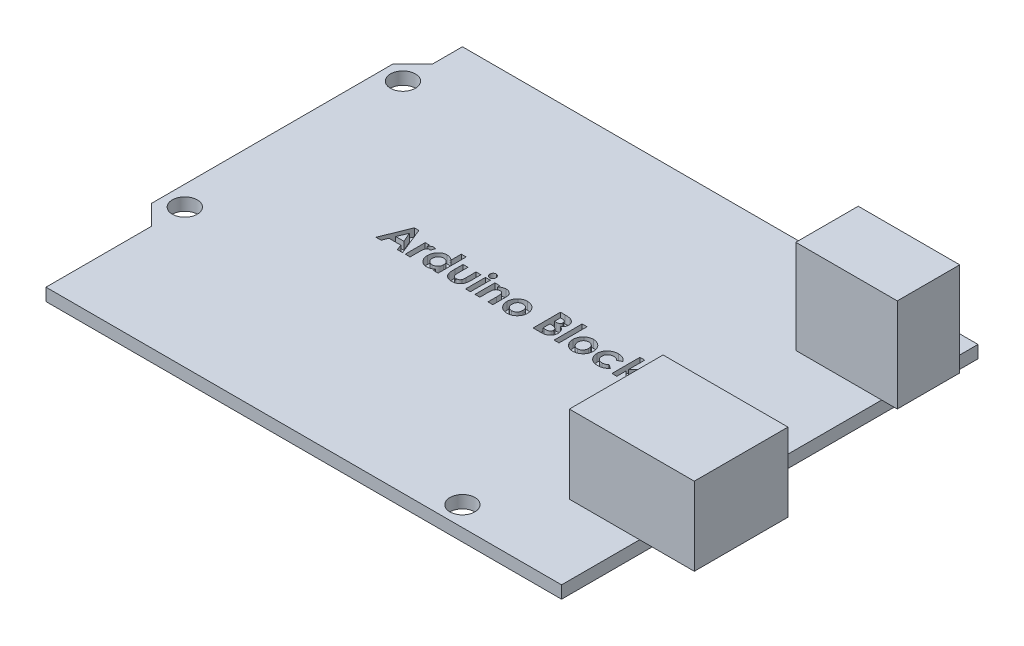
from build123d import *

# Parameters (mm, degrees)
SKETCH1_W           = 68.58
SKETCH1_H           = 53.34
PCB_DEPTH           = 1.6
SKETCH2_W           = 13
SKETCH2_H           = 8
CHARGING_PORT_DEPTH = 12
SKETCH4_W           = 16
SKETCH4_H           = 12
ETHERNET_DEPTH      = 10
SKETCH5_W           = 0.628205128
SKETCH5_H           = 2.557692308
SKETCH5_W_2         = 0.628205129
SKETCH5_H_2         = 3.58974359
CUT_EXTRUDE1_DEPTH  = 1
SKETCH6_R           = 1.6
CUT_EXTRUDE2_DEPTH  = 51.597954557


with BuildPart() as part:
    # Sketch1 → PCB (new body)
    with BuildSketch(Plane(origin=(0, 0, 0), x_dir=(1, 0, 0), z_dir=(0, 1, 0))):
        Rectangle(SKETCH1_W, SKETCH1_H)
    extrude(amount=PCB_DEPTH)

    # Sketch2 → Charging Port (add)
    with BuildSketch(Plane(origin=(0, 1.6, 0), x_dir=(1, 0, 0), z_dir=(0, 1, 0))):
        with Locations((29.79, 18.33)):
            Rectangle(SKETCH2_W, SKETCH2_H)
    extrude(amount=CHARGING_PORT_DEPTH)

    # Sketch4 → Ethernet (add)
    with BuildSketch(Plane(origin=(0, 1.6, 0), x_dir=(1, 0, 0), z_dir=(0, 1, 0))):
        with Locations((33.29, -10.67)):
            Rectangle(SKETCH4_W, SKETCH4_H)
    extrude(amount=ETHERNET_DEPTH)

    # Sketch5 → Cut-Extrude1 (cut)
    # profile 1 of 13: a face of its own
    with BuildSketch(Plane(origin=(0, 1.6, 0), x_dir=(1, 0, 0), z_dir=(0, 1, 0))):
        Polygon((-14.739683494, 3.5), (-14.157051282, 3.5), (-12.743589744, 0), (-13.414563301, 0), (-13.686598558, 0.717948718), (-15.211538462, 0.717948718), (-15.483573718, 0), (-16.153846154, 0), align=None)
        Polygon((-14.448717949, 2.561197917), (-14.973157051, 1.346153846), (-13.924278846, 1.346153846), align=None, mode=Mode.SUBTRACT)
    # profile 2 of 13: a face of its own
    with BuildSketch(Plane(origin=(0, 1.6, 0), x_dir=(1, 0, 0), z_dir=(0, 1, 0))):
        with BuildLine():
            Line((-12.407051282, 2.557692308), (-11.868589744, 2.557692308))
            Line((-11.868589744, 2.557692308), (-11.868589744, 2.242888622))
            add(Edge.make_bspline(
                [(-11.868589744, 2.242888622), (-11.8533577, 2.270865312), (-11.82358604, 2.325546914), (-11.768893003, 2.398946135), (-11.706059427, 2.460760911), (-11.637343116, 2.512284155), (-11.562535806, 2.552441464), (-11.483640701, 2.58105861), (-11.40133275, 2.599655789), (-11.345185055, 2.601587684), (-11.316806891, 2.602564103)],
                knots=[0, 0, 0, 0, 1.09866127, 2.147379032, 3.14564304, 4.131443017, 5.102343063, 6.064490016, 7.021754664, 8, 8, 8, 8], degree=3))
            add(Edge.make_bspline(
                [(-11.316806891, 2.602564103), (-11.296200803, 2.601599197), (-11.254239449, 2.599634305), (-11.190284442, 2.588212359), (-11.125406675, 2.567559309), (-11.082711515, 2.548963982), (-11.060897436, 2.539463141)],
                knots=[0, 0, 0, 0, 0.931404136, 1.896671404, 2.925354185, 4, 4, 4, 4], degree=3))
            Line((-11.060897436, 2.539463141), (-11.255809295, 2.007311699))
            add(Edge.make_bspline(
                [(-11.255809295, 2.007311699), (-11.273231632, 2.01572933), (-11.305978918, 2.031551235), (-11.353522292, 2.050222714), (-11.396669875, 2.061615137), (-11.424024651, 2.063314987), (-11.436698718, 2.064102564)],
                knots=[0, 0, 0, 0, 1.214386998, 2.282580073, 3.20428172, 4, 4, 4, 4], degree=3))
            add(Edge.make_bspline(
                [(-11.436698718, 2.064102564), (-11.448665502, 2.063580674), (-11.472206228, 2.062554025), (-11.50695168, 2.053755997), (-11.539674661, 2.038584069), (-11.571952089, 2.019147325), (-11.601237633, 1.992128796), (-11.630505088, 1.960850051), (-11.656297136, 1.922232281), (-11.683515227, 1.879248741), (-11.706690459, 1.826636927), (-11.726562506, 1.763829263), (-11.744268659, 1.690099021), (-11.75645291, 1.60505473), (-11.768229478, 1.50951934), (-11.775239181, 1.402791634), (-11.780463601, 1.285209094), (-11.780783039, 1.203132237), (-11.780949519, 1.160356571)],
                knots=[0, 0, 0, 0, 0.544232178, 1.070598461, 1.618251235, 2.182094276, 2.777567932, 3.425210017, 4.127676488, 4.886675562, 5.738955394, 6.734782583, 7.883056018, 9.186093582, 10.642914445, 12.264202625, 14.053029461, 16, 16, 16, 16], degree=3))
            Line((-11.780949519, 1.160356571), (-11.778846154, 1.035556891))
            Line((-11.778846154, 1.035556891), (-11.778846154, 0))
            Line((-11.778846154, 0), (-12.407051282, 0))
            Line((-12.407051282, 0), (-12.407051282, 2.557692308))
        make_face()
    # profile 3 of 13: a face of its own
    with BuildSketch(Plane(origin=(0, 1.6, 0), x_dir=(1, 0, 0), z_dir=(0, 1, 0))):
        with BuildLine():
            Line((-8.817307692, 3.58974359), (-8.189102564, 3.58974359))
            Line((-8.189102564, 3.58974359), (-8.189102564, 0))
            Line((-8.189102564, 0), (-8.817307692, 0))
            Line((-8.817307692, 0), (-8.817307692, 0.279046474))
            add(Edge.make_bspline(
                [(-8.817307692, 0.279046474), (-8.848435025, 0.251884388), (-8.908847031, 0.199168144), (-9.004036803, 0.130767476), (-9.099504731, 0.074345765), (-9.195709541, 0.029408949), (-9.29412986, -0.003772264), (-9.395474275, -0.027796237), (-9.501202253, -0.041963762), (-9.573074676, -0.043892353), (-9.609575321, -0.044871795)],
                knots=[0, 0, 0, 0, 1.129196829, 2.191548051, 3.199897424, 4.157751732, 5.089409408, 6.034969131, 7.002052659, 8, 8, 8, 8], degree=3))
            add(Edge.make_bspline(
                [(-9.609575321, -0.044871795), (-9.650548917, -0.043950017), (-9.731515065, -0.042128532), (-9.850323898, -0.022954463), (-9.965045639, 0.006395724), (-10.075587164, 0.047929908), (-10.181747354, 0.101750066), (-10.284338655, 0.166451958), (-10.381602341, 0.244307005), (-10.474348098, 0.331946618), (-10.559265557, 0.428350817), (-10.633501201, 0.532181523), (-10.696076332, 0.641966128), (-10.747340788, 0.757340645), (-10.787666903, 0.878220396), (-10.816413652, 1.004988774), (-10.833374268, 1.137691055), (-10.835473514, 1.228082651), (-10.836538462, 1.273938301)],
                knots=[0, 0, 0, 0, 0.980476535, 1.937477201, 2.874147792, 3.812856188, 4.758993464, 5.720109578, 6.712210464, 7.737600662, 8.772720504, 9.783789959, 10.789002326, 11.793715968, 12.802552247, 13.835794126, 14.902098527, 16, 16, 16, 16], degree=3))
            add(Edge.make_bspline(
                [(-10.836538462, 1.273938301), (-10.835420795, 1.321421887), (-10.833228368, 1.414566232), (-10.817190895, 1.551251128), (-10.788974631, 1.681162718), (-10.750499727, 1.804480946), (-10.701008444, 1.921227119), (-10.640731368, 2.031592502), (-10.568848485, 2.13528862), (-10.486016207, 2.23055049), (-10.39657769, 2.317862595), (-10.300894289, 2.393874707), (-10.200462282, 2.458450533), (-10.095174943, 2.511169467), (-9.985047307, 2.551907991), (-9.870514156, 2.581691179), (-9.751067045, 2.599562137), (-9.669698705, 2.601555137), (-9.628505609, 2.602564103)],
                knots=[0, 0, 0, 0, 1.136281865, 2.228943489, 3.287578264, 4.313574083, 5.316051562, 6.317280042, 7.318008486, 8.329309503, 9.333984563, 10.305318864, 11.248632312, 12.186624717, 13.117503092, 14.05354244, 15.014596925, 16, 16, 16, 16], degree=3))
            add(Edge.make_bspline(
                [(-9.628505609, 2.602564103), (-9.590372055, 2.601354246), (-9.51496295, 2.598961754), (-9.403570713, 2.583901614), (-9.296390225, 2.555544685), (-9.192119784, 2.519008867), (-9.09211354, 2.469844118), (-8.995834205, 2.410785484), (-8.903028099, 2.341082936), (-8.846242388, 2.287180892), (-8.817307692, 2.259715545)],
                knots=[0, 0, 0, 0, 1.011899165, 2.001030639, 2.974036179, 3.948778736, 4.92769327, 5.924124564, 6.942254589, 8, 8, 8, 8], degree=3))
            Line((-8.817307692, 2.259715545), (-8.817307692, 3.58974359))
        make_face()
        with BuildLine():
            add(Edge.make_bspline(
                [(-9.496694712, 2.019230769), (-9.521726834, 2.018462697), (-9.57078816, 2.016957326), (-9.642939553, 2.007902416), (-9.711894641, 1.99194726), (-9.777161641, 1.968376944), (-9.83971327, 1.939664864), (-9.898599674, 1.903703457), (-9.954306858, 1.861197838), (-10.006507203, 1.813177067), (-10.054095509, 1.76039346), (-10.095119407, 1.702795109), (-10.129983092, 1.641933961), (-10.159468708, 1.577627029), (-10.18057372, 1.509113362), (-10.197288881, 1.437284886), (-10.205962967, 1.3615548), (-10.207535305, 1.309947091), (-10.208333333, 1.283754006)],
                knots=[0, 0, 0, 0, 1.04836806, 2.054732945, 3.03993516, 4.00574415, 4.955904794, 5.917688631, 6.888591924, 7.88601754, 8.884115178, 9.859153345, 10.841239365, 11.818093293, 12.814750328, 13.83810466, 14.90274714, 16, 16, 16, 16], degree=3))
            add(Edge.make_bspline(
                [(-10.208333333, 1.283754006), (-10.207547496, 1.257323336), (-10.205999011, 1.205242005), (-10.197148629, 1.128873109), (-10.181034949, 1.055995388), (-10.157525698, 0.98719801), (-10.128815448, 0.92155267), (-10.093868618, 0.859362327), (-10.050942558, 0.801726584), (-10.003312535, 0.747281587), (-9.950041308, 0.698664318), (-9.89401891, 0.655496646), (-9.83448012, 0.619378283), (-9.772070891, 0.590187194), (-9.707001295, 0.566398909), (-9.638455558, 0.550644277), (-9.567105172, 0.540572639), (-9.518463729, 0.539170098), (-9.493890224, 0.538461538)],
                knots=[0, 0, 0, 0, 1.099136573, 2.165835871, 3.191374663, 4.196217796, 5.183857741, 6.167377911, 7.154730987, 8.166690795, 9.170734848, 10.148332609, 11.103258353, 12.059567475, 13.009337315, 13.978056681, 14.978520572, 16, 16, 16, 16], degree=3))
            add(Edge.make_bspline(
                [(-9.493890224, 0.538461538), (-9.468391849, 0.539233916), (-9.418401173, 0.540748197), (-9.345072666, 0.549720472), (-9.275191264, 0.565734128), (-9.209047711, 0.58943939), (-9.145631728, 0.617945374), (-9.085515587, 0.653204068), (-9.029351638, 0.695612148), (-8.976855437, 0.744067028), (-8.928752789, 0.797281645), (-8.887161563, 0.855635307), (-8.850934085, 0.917261705), (-8.822442839, 0.98361791), (-8.799816795, 1.053543), (-8.78358313, 1.127470944), (-8.774752957, 1.205481445), (-8.773218016, 1.258726651), (-8.772435897, 1.285857372)],
                knots=[0, 0, 0, 0, 1.050008698, 2.058587853, 3.036635738, 3.995319155, 4.947022481, 5.895997462, 6.858296291, 7.838991643, 8.833936038, 9.806048392, 10.784806122, 11.771666913, 12.772873988, 13.80724452, 14.882696879, 16, 16, 16, 16], degree=3))
            add(Edge.make_bspline(
                [(-8.772435897, 1.285857372), (-8.773208297, 1.312521457), (-8.774717019, 1.36460416), (-8.783621212, 1.440985838), (-8.799970127, 1.513462175), (-8.82213049, 1.58216639), (-8.851128603, 1.646941393), (-8.887383493, 1.707068983), (-8.928518486, 1.764632355), (-8.977153701, 1.81640935), (-9.029365518, 1.86451338), (-9.086355448, 1.905639009), (-9.146328001, 1.941082217), (-9.209651647, 1.970182458), (-9.276912735, 1.991514038), (-9.346913559, 2.0080303), (-9.420746278, 2.016951892), (-9.470965436, 2.018458747), (-9.496694712, 2.019230769)],
                knots=[0, 0, 0, 0, 1.106611376, 2.161533483, 3.185006901, 4.184773755, 5.152708835, 6.122342771, 7.094156588, 8.082475533, 9.064254463, 10.03606828, 10.992420271, 11.951521816, 12.920622147, 13.915721683, 14.932141191, 16, 16, 16, 16], degree=3))
        make_face(mode=Mode.SUBTRACT)
    # profile 4 of 13: a face of its own
    with BuildSketch(Plane(origin=(0, 1.6, 0), x_dir=(1, 0, 0), z_dir=(0, 1, 0))):
        with BuildLine():
            Line((-7.560897436, 2.557692308), (-6.932692308, 2.557692308))
            Line((-6.932692308, 2.557692308), (-6.932692308, 1.330028045))
            add(Edge.make_bspline(
                [(-6.932692308, 1.330028045), (-6.932636523, 1.301279111), (-6.932529458, 1.246102887), (-6.92955019, 1.166859026), (-6.925369689, 1.094394144), (-6.920152706, 1.028622792), (-6.912366025, 0.969703171), (-6.90337663, 0.917747761), (-6.893185556, 0.872382216), (-6.876613583, 0.821816268), (-6.850686432, 0.766481563), (-6.811531844, 0.707737276), (-6.764104218, 0.656940644), (-6.709044333, 0.613640874), (-6.645789891, 0.579519704), (-6.575212375, 0.556396308), (-6.498199792, 0.540854981), (-6.444560644, 0.539280379), (-6.416666667, 0.538461538)],
                knots=[0, 0, 0, 0, 1.267339619, 2.432334223, 3.495366327, 4.467371443, 5.340232306, 6.114347373, 6.791623365, 7.387877112, 8.457231658, 9.474542289, 10.487879852, 11.508108106, 12.54995813, 13.638205937, 14.771795776, 16, 16, 16, 16], degree=3))
            add(Edge.make_bspline(
                [(-6.416666667, 0.538461538), (-6.388797443, 0.539396129), (-6.335019575, 0.541199563), (-6.257494598, 0.55526322), (-6.186750844, 0.579361764), (-6.122061729, 0.612048595), (-6.06533494, 0.655794351), (-6.015945245, 0.707920523), (-5.974360281, 0.76926797), (-5.954376788, 0.815031407), (-5.944110577, 0.838541667)],
                knots=[0, 0, 0, 0, 1.116871431, 2.155171802, 3.144773418, 4.104381479, 5.046960687, 6.001340237, 6.973219418, 8, 8, 8, 8], degree=3))
            add(Edge.make_bspline(
                [(-5.944110577, 0.838541667), (-5.940343222, 0.848985135), (-5.932027222, 0.872037886), (-5.924625817, 0.911807054), (-5.916659701, 0.958708348), (-5.910358221, 1.013697578), (-5.906792621, 1.076434189), (-5.902972445, 1.146997253), (-5.901025615, 1.225316491), (-5.900773148, 1.28024765), (-5.900641026, 1.308994391)],
                knots=[0, 0, 0, 0, 0.56094539, 1.238222264, 2.041156151, 2.969685991, 4.036367568, 5.220421584, 6.545382566, 8, 8, 8, 8], degree=3))
            Line((-5.900641026, 1.308994391), (-5.900641026, 2.557692308))
            Line((-5.900641026, 2.557692308), (-5.272435897, 2.557692308))
            Line((-5.272435897, 2.557692308), (-5.272435897, 1.482872596))
            add(Edge.make_bspline(
                [(-5.272435897, 1.482872596), (-5.272544671, 1.429580756), (-5.272753221, 1.327404167), (-5.278730164, 1.180835172), (-5.286979022, 1.047574701), (-5.297601965, 0.927255846), (-5.312908312, 0.819828674), (-5.331697669, 0.725545105), (-5.352484697, 0.643782101), (-5.371547176, 0.595336955), (-5.380408654, 0.572816506)],
                knots=[0, 0, 0, 0, 1.388070971, 2.661352173, 3.82033814, 4.865898334, 5.806910977, 6.645039373, 7.370126333, 8, 8, 8, 8], degree=3))
            add(Edge.make_bspline(
                [(-5.380408654, 0.572816506), (-5.391766786, 0.548577546), (-5.414186764, 0.500731919), (-5.453089592, 0.432706035), (-5.49502902, 0.368256899), (-5.542000542, 0.308901581), (-5.593045323, 0.254036828), (-5.646720488, 0.202415433), (-5.705443287, 0.156139496), (-5.767690822, 0.114018206), (-5.834331669, 0.076627493), (-5.904909389, 0.043492987), (-5.980186685, 0.016527181), (-6.059510814, -0.006330142), (-6.143247409, -0.023376024), (-6.231227792, -0.03628698), (-6.323548456, -0.04295941), (-6.386509438, -0.044223889), (-6.418770032, -0.044871795)],
                knots=[0, 0, 0, 0, 0.997311338, 1.968606903, 2.91805772, 3.860812155, 4.785445165, 5.709667791, 6.633356648, 7.568312411, 8.508286151, 9.478643871, 10.470653671, 11.485274776, 12.552984541, 13.653035246, 14.797438149, 16, 16, 16, 16], degree=3))
            add(Edge.make_bspline(
                [(-6.418770032, -0.044871795), (-6.453620538, -0.044456469), (-6.521811162, -0.043643817), (-6.62143671, -0.033692011), (-6.716381196, -0.020815668), (-6.805584572, 0.001076476), (-6.890292604, 0.026439619), (-6.969532795, 0.058809736), (-7.043628942, 0.096867822), (-7.112726839, 0.140388247), (-7.176290586, 0.189769831), (-7.235733596, 0.242878005), (-7.289136792, 0.301825775), (-7.338243572, 0.364792811), (-7.382505876, 0.432358629), (-7.421945673, 0.504282986), (-7.456596371, 0.580893031), (-7.475084237, 0.634585733), (-7.48447516, 0.661858974)],
                knots=[0, 0, 0, 0, 1.211240017, 2.369985978, 3.478996442, 4.539426614, 5.559871561, 6.551301256, 7.510778031, 8.453136967, 9.386094087, 10.30661716, 11.221130616, 12.147659962, 13.080758632, 14.026335491, 14.997475882, 16, 16, 16, 16], degree=3))
            add(Edge.make_bspline(
                [(-7.48447516, 0.661858974), (-7.490881954, 0.683040418), (-7.504683682, 0.728670185), (-7.519585319, 0.804501531), (-7.531504191, 0.891901404), (-7.543098492, 0.990955773), (-7.551186888, 1.101830703), (-7.55647356, 1.22435011), (-7.560045601, 1.358753581), (-7.560605126, 1.45225447), (-7.560897436, 1.501101763)],
                knots=[0, 0, 0, 0, 0.627914866, 1.352675004, 2.190563461, 3.132055958, 4.183353232, 5.345633452, 6.613289997, 8, 8, 8, 8], degree=3))
            Line((-7.560897436, 1.501101763), (-7.560897436, 2.557692308))
        make_face()
    # profile 5 of 13: a face of its own
    with BuildSketch(Plane(origin=(0, 1.6, 0), x_dir=(1, 0, 0), z_dir=(0, 1, 0))):
        with BuildLine():
            add(Edge.make_bspline(
                [(-4.376402244, 3.634615385), (-4.349326607, 3.633286951), (-4.296160986, 3.630678445), (-4.219993999, 3.605251308), (-4.150088141, 3.565344177), (-4.088289424, 3.510590642), (-4.03689103, 3.445204906), (-3.997620749, 3.372001228), (-3.975744911, 3.29089391), (-3.97270668, 3.234865823), (-3.971153846, 3.206229968)],
                knots=[0, 0, 0, 0, 0.989868614, 1.943702388, 2.910836514, 3.924849579, 4.949916355, 5.946401046, 6.950409252, 8, 8, 8, 8], degree=3))
            add(Edge.make_bspline(
                [(-3.971153846, 3.206229968), (-3.972651122, 3.177805144), (-3.975568637, 3.12241802), (-3.998124235, 3.042411771), (-4.035818344, 2.969243648), (-4.087633032, 2.904829012), (-4.14876177, 2.850957315), (-4.217140132, 2.810325694), (-4.292577218, 2.786313063), (-4.344917869, 2.7834865), (-4.371494391, 2.782051282)],
                knots=[0, 0, 0, 0, 1.05296456, 2.051751585, 3.055639087, 4.085634717, 5.099016424, 6.062201612, 7.016062274, 8, 8, 8, 8], degree=3))
            add(Edge.make_bspline(
                [(-4.371494391, 2.782051282), (-4.398806375, 2.783374966), (-4.452434535, 2.785974073), (-4.529226249, 2.811460703), (-4.600064472, 2.85105354), (-4.661595106, 2.906925775), (-4.713582126, 2.972776125), (-4.751137067, 3.047684049), (-4.774628611, 3.129345977), (-4.777417037, 3.186203877), (-4.778846154, 3.215344551)],
                knots=[0, 0, 0, 0, 0.989065327, 1.942068821, 2.907541208, 3.917690034, 4.939857478, 5.938239964, 6.943311734, 8, 8, 8, 8], degree=3))
            add(Edge.make_bspline(
                [(-4.778846154, 3.215344551), (-4.777290884, 3.243286705), (-4.77423578, 3.298175033), (-4.752228903, 3.377479097), (-4.713859088, 3.449452107), (-4.662830921, 3.513640896), (-4.601575005, 3.567373072), (-4.531711113, 3.606068197), (-4.456056732, 3.630445121), (-4.403227897, 3.633210943), (-4.376402244, 3.634615385)],
                knots=[0, 0, 0, 0, 1.038616768, 2.040212704, 3.031499824, 4.052181184, 5.074969369, 6.039807101, 7.004644834, 8, 8, 8, 8], degree=3))
        make_face()
    # profile 6 of 13: a face of its own
    with BuildSketch(Plane(origin=(0, 1.6, 0), x_dir=(1, 0, 0), z_dir=(0, 1, 0))):
        with Locations((-4.375, 1.278846154)):
            Rectangle(SKETCH5_W, SKETCH5_H)
    # profile 7 of 13: a face of its own
    with BuildSketch(Plane(origin=(0, 1.6, 0), x_dir=(1, 0, 0), z_dir=(0, 1, 0))):
        with BuildLine():
            Line((-3.477564103, 2.557692308), (-2.849358974, 2.557692308))
            Line((-2.849358974, 2.557692308), (-2.849358974, 2.287059295))
            add(Edge.make_bspline(
                [(-2.849358974, 2.287059295), (-2.813520183, 2.314935445), (-2.745025286, 2.368212186), (-2.640901217, 2.436140303), (-2.542620987, 2.491736739), (-2.447993825, 2.534026233), (-2.355239319, 2.564451706), (-2.262855242, 2.586310593), (-2.169465808, 2.600307439), (-2.10668544, 2.601812285), (-2.075320513, 2.602564103)],
                knots=[0, 0, 0, 0, 1.276643801, 2.439914479, 3.493451431, 4.44993799, 5.350072675, 6.235028322, 7.118224225, 8, 8, 8, 8], degree=3))
            add(Edge.make_bspline(
                [(-2.075320513, 2.602564103), (-2.043505015, 2.601704931), (-1.981048521, 2.600018304), (-1.889084775, 2.588221719), (-1.801222347, 2.5667364), (-1.716473296, 2.538209707), (-1.635700223, 2.500556109), (-1.557913607, 2.45584857), (-1.484784279, 2.401391763), (-1.439748001, 2.359920073), (-1.416967147, 2.338942308)],
                knots=[0, 0, 0, 0, 1.048836932, 2.058954983, 3.049370783, 4.026390553, 5.001981509, 5.982488534, 6.97947532, 8, 8, 8, 8], degree=3))
            add(Edge.make_bspline(
                [(-1.416967147, 2.338942308), (-1.398696064, 2.319502053), (-1.362020176, 2.280479265), (-1.315868178, 2.213701279), (-1.276264572, 2.140901052), (-1.243814921, 2.061238809), (-1.219835935, 1.974276857), (-1.201388575, 1.881065574), (-1.191037439, 1.781083044), (-1.189759543, 1.71239599), (-1.189102564, 1.677083333)],
                knots=[0, 0, 0, 0, 0.889584746, 1.785680191, 2.700364693, 3.65222533, 4.649950538, 5.707241244, 6.821271309, 8, 8, 8, 8], degree=3))
            Line((-1.189102564, 1.677083333), (-1.189102564, 0))
            Line((-1.189102564, 0), (-1.817307692, 0))
            Line((-1.817307692, 0), (-1.817307692, 1.110576923))
            add(Edge.make_bspline(
                [(-1.817307692, 1.110576923), (-1.817440544, 1.146802008), (-1.817695129, 1.216220658), (-1.819649781, 1.31556918), (-1.823466399, 1.405293797), (-1.826945147, 1.485557872), (-1.833775313, 1.556076413), (-1.839934867, 1.617295857), (-1.849386106, 1.668660815), (-1.8616837, 1.723911535), (-1.883158328, 1.783067534), (-1.916496642, 1.845398153), (-1.958790969, 1.898349402), (-2.008313838, 1.942292498), (-2.065010557, 1.977055518), (-2.128196027, 2.001513467), (-2.197531499, 2.016756262), (-2.245843642, 2.018384947), (-2.270933494, 2.019230769)],
                knots=[0, 0, 0, 0, 1.49886392, 2.872294502, 4.110984203, 5.214877267, 6.195405875, 7.042225351, 7.75923308, 8.355011229, 9.382752534, 10.352059385, 11.267231453, 12.171456522, 13.078624015, 14.003401117, 14.963110155, 16, 16, 16, 16], degree=3))
            add(Edge.make_bspline(
                [(-2.270933494, 2.019230769), (-2.303563901, 2.017576073), (-2.367395322, 2.014339164), (-2.459714702, 1.989929922), (-2.544508514, 1.948416985), (-2.621083924, 1.890971429), (-2.688711614, 1.820047771), (-2.744411574, 1.735463173), (-2.790096983, 1.639259079), (-2.809742388, 1.569014464), (-2.819911859, 1.532652244)],
                knots=[0, 0, 0, 0, 0.984188326, 1.925263693, 2.85911992, 3.81709677, 4.80007086, 5.801799564, 6.862098548, 8, 8, 8, 8], degree=3))
            add(Edge.make_bspline(
                [(-2.819911859, 1.532652244), (-2.822439376, 1.521232445), (-2.828076249, 1.495763997), (-2.832711863, 1.452737838), (-2.839160339, 1.401691466), (-2.841576424, 1.341701086), (-2.845777731, 1.273050607), (-2.847331575, 1.195649206), (-2.848888199, 1.109648654), (-2.849196851, 1.049580536), (-2.849358974, 1.018028846)],
                knots=[0, 0, 0, 0, 0.543362196, 1.211806945, 2.009705693, 2.934833164, 4.000995085, 5.207458376, 6.533175157, 8, 8, 8, 8], degree=3))
            Line((-2.849358974, 1.018028846), (-2.849358974, 0))
            Line((-2.849358974, 0), (-3.477564103, 0))
            Line((-3.477564103, 0), (-3.477564103, 2.557692308))
        make_face()
    # profile 8 of 13: a face of its own
    with BuildSketch(Plane(origin=(0, 1.6, 0), x_dir=(1, 0, 0), z_dir=(0, 1, 0))):
        with BuildLine():
            add(Edge.make_bspline(
                [(0.657652244, 2.602564103), (0.687352569, 2.602035565), (0.746172672, 2.600988821), (0.833777867, 2.592275633), (0.919851521, 2.578059708), (1.004888374, 2.559652567), (1.08809878, 2.533861408), (1.169919167, 2.502928902), (1.251081113, 2.467414767), (1.329570194, 2.425140525), (1.405953437, 2.379290253), (1.478369296, 2.328713642), (1.54621641, 2.273807953), (1.61075425, 2.215846218), (1.668975249, 2.152304971), (1.724600042, 2.086245897), (1.774623356, 2.01530233), (1.820937739, 1.941202999), (1.862171102, 1.864376408), (1.897974694, 1.785356989), (1.929048845, 1.705237242), (1.953379283, 1.623041253), (1.973522643, 1.539852886), (1.986234535, 1.454652728), (1.995271809, 1.368316001), (1.996285174, 1.310187012), (1.996794872, 1.280949519)],
                knots=[0, 0, 0, 0, 1.022364134, 2.024744242, 3.027414945, 4.024939316, 5.017584196, 6.023349371, 7.035562955, 8.064994934, 9.090267829, 10.101425541, 11.102933353, 12.093946398, 13.084502048, 14.067315274, 15.065326281, 16.070028806, 17.074376865, 18.064572984, 19.055292013, 20.030201733, 21.013838017, 21.999348303, 22.993720005, 24, 24, 24, 24], degree=3))
            add(Edge.make_bspline(
                [(1.996794872, 1.280949519), (1.99625697, 1.251483609), (1.995187498, 1.192898699), (1.986561492, 1.105749868), (1.972291153, 1.020149054), (1.953813364, 0.935591969), (1.928118724, 0.8531606), (1.898097279, 0.771639876), (1.861244774, 0.692140957), (1.820501615, 0.613796583), (1.77388945, 0.538912191), (1.723909436, 0.46725794), (1.668517628, 0.400713659), (1.610762704, 0.337215623), (1.547905218, 0.278911053), (1.480948493, 0.224853238), (1.410472188, 0.174381296), (1.335969504, 0.128679395), (1.258394697, 0.088522765), (1.17905605, 0.052318285), (1.097489636, 0.022175471), (1.01386426, -0.002405164), (0.928129207, -0.021437335), (0.840473758, -0.034366115), (0.751086689, -0.043357932), (0.690861202, -0.044363925), (0.660456731, -0.044871795)],
                knots=[0, 0, 0, 0, 1.012026251, 2.012137606, 3.004615893, 3.992048833, 4.982446996, 5.968083444, 6.973977695, 7.990229942, 8.999482246, 10.001782172, 10.988562221, 11.971415814, 12.948383116, 13.930088534, 14.925840678, 15.924049238, 16.929462851, 17.924729459, 18.917889337, 19.913673841, 20.916777188, 21.931792057, 22.95587778, 24, 24, 24, 24], degree=3))
            add(Edge.make_bspline(
                [(0.660456731, -0.044871795), (0.615999194, -0.043566878), (0.528372711, -0.040994868), (0.39931962, -0.023377272), (0.2753422, 0.006947229), (0.156238432, 0.049218916), (0.041853597, 0.103388507), (-0.066814045, 0.170431602), (-0.170845441, 0.249028315), (-0.268438689, 0.338514339), (-0.357847325, 0.43668861), (-0.435956526, 0.541489047), (-0.502277558, 0.651344866), (-0.556750753, 0.766381341), (-0.598792952, 0.886756217), (-0.629154593, 1.012109616), (-0.646793728, 1.142793888), (-0.649343985, 1.231584552), (-0.650641026, 1.276742788)],
                knots=[0, 0, 0, 0, 1.029999031, 2.030143771, 3.011211297, 3.982305373, 4.953580601, 5.938004764, 6.935448627, 7.970290061, 9.001484052, 10.007591832, 10.993831261, 11.969999897, 12.951306496, 13.942897864, 14.953773953, 16, 16, 16, 16], degree=3))
            add(Edge.make_bspline(
                [(-0.650641026, 1.276742788), (-0.649298753, 1.324961886), (-0.646660544, 1.419735557), (-0.625711999, 1.558581145), (-0.592259432, 1.691519215), (-0.544240381, 1.818177898), (-0.482900265, 1.938790798), (-0.408017886, 2.053103529), (-0.31922317, 2.161141984), (-0.251224198, 2.226487346), (-0.216646635, 2.259715545)],
                knots=[0, 0, 0, 0, 1.043912699, 2.05178951, 3.033892, 4.007821512, 4.978932272, 5.95884105, 6.962068106, 8, 8, 8, 8], degree=3))
            add(Edge.make_bspline(
                [(-0.216646635, 2.259715545), (-0.184918264, 2.287257984), (-0.122324758, 2.341593515), (-0.020630911, 2.410509228), (0.083492113, 2.470031379), (0.191292274, 2.518969657), (0.303070089, 2.55586833), (0.418252763, 2.582727262), (0.536816343, 2.599224805), (0.617168919, 2.601445347), (0.657652244, 2.602564103)],
                knots=[0, 0, 0, 0, 1.048115528, 2.067714963, 3.060638214, 4.039924844, 5.017819947, 5.994373833, 6.98952318, 8, 8, 8, 8], degree=3))
        make_face()
        with BuildLine():
            add(Edge.make_bspline(
                [(0.671674679, 2.019230769), (0.647352301, 2.018422374), (0.599473437, 2.016831039), (0.528994491, 2.00829077), (0.462334761, 1.990786755), (0.398170262, 1.968526438), (0.33763607, 1.938756401), (0.279074368, 1.903918597), (0.225530236, 1.860323372), (0.174412503, 1.8125026), (0.128008995, 1.759398916), (0.0884688, 1.701542492), (0.05313876, 1.641146793), (0.026349782, 1.576000659), (0.004179342, 1.50788472), (-0.010825346, 1.435698433), (-0.021267561, 1.360248155), (-0.022042748, 1.308564198), (-0.022435897, 1.282351763)],
                knots=[0, 0, 0, 0, 1.030650113, 2.02884584, 2.99876339, 3.944280128, 4.900564847, 5.851248946, 6.823638398, 7.81794922, 8.81432732, 9.802856497, 10.78262424, 11.771747962, 12.779760563, 13.812642396, 14.89064281, 16, 16, 16, 16], degree=3))
            add(Edge.make_bspline(
                [(-0.022435897, 1.282351763), (-0.021975859, 1.255214945), (-0.021076802, 1.202181246), (-0.01176688, 1.124744915), (0.003585488, 1.051258349), (0.025396392, 0.981835071), (0.052827287, 0.915976767), (0.086481813, 0.854052949), (0.126715158, 0.79643594), (0.172330005, 0.74319669), (0.222276315, 0.694870834), (0.277003576, 0.653399393), (0.334220018, 0.617366215), (0.395244216, 0.588426011), (0.459209454, 0.566081826), (0.526305618, 0.549630554), (0.596885297, 0.540767406), (0.645009483, 0.53924073), (0.669571314, 0.538461538)],
                knots=[0, 0, 0, 0, 1.141730614, 2.231293227, 3.276944405, 4.297399982, 5.28939179, 6.275415646, 7.257752684, 8.24146775, 9.222424823, 10.176631434, 11.126518621, 12.063689483, 13.012557477, 13.974037417, 14.965980454, 16, 16, 16, 16], degree=3))
            add(Edge.make_bspline(
                [(0.669571314, 0.538461538), (0.694145429, 0.539152646), (0.742324961, 0.540507618), (0.812987522, 0.550654221), (0.880426328, 0.566622974), (0.944937879, 0.589159468), (1.006000594, 0.618719121), (1.063848226, 0.654924687), (1.118989668, 0.696972959), (1.169606262, 0.746210632), (1.216461075, 0.799615915), (1.257549943, 0.857537081), (1.291885351, 0.919460915), (1.320046534, 0.984997792), (1.341900195, 1.054057633), (1.356998402, 1.126897124), (1.3674462, 1.20329053), (1.368203855, 1.255672549), (1.368589744, 1.282351763)],
                knots=[0, 0, 0, 0, 1.031504075, 2.022346795, 2.991027682, 3.937587355, 4.885570121, 5.833146507, 6.798790848, 7.791235734, 8.792807298, 9.778388351, 10.766749885, 11.760164525, 12.768777521, 13.802286646, 14.880660483, 16, 16, 16, 16], degree=3))
            add(Edge.make_bspline(
                [(1.368589744, 1.282351763), (1.368123853, 1.309021652), (1.367209624, 1.361356626), (1.357899039, 1.437853353), (1.342697334, 1.510457406), (1.320605118, 1.578858773), (1.293337269, 1.643837803), (1.25965948, 1.705061894), (1.219227718, 1.762229502), (1.173391124, 1.815057158), (1.122696088, 1.862704893), (1.068919024, 1.905195105), (1.010830215, 1.940337774), (0.949519443, 1.969307879), (0.88482359, 1.99159624), (0.816815286, 2.008140746), (0.745286107, 2.016877775), (0.696468265, 2.01843824), (0.671674679, 2.019230769)],
                knots=[0, 0, 0, 0, 1.123894411, 2.205445421, 3.243160173, 4.246488011, 5.231014757, 6.210004299, 7.185865357, 8.177612767, 9.153374344, 10.115157457, 11.061423229, 12.009021698, 12.96873347, 13.94135618, 14.954456845, 16, 16, 16, 16], degree=3))
        make_face(mode=Mode.SUBTRACT)
    # profile 9 of 13: a face of its own
    with BuildSketch(Plane(origin=(0, 1.6, 0), x_dir=(1, 0, 0), z_dir=(0, 1, 0))):
        with BuildLine():
            Line((3.971153846, 0), (3.971153846, 3.5))
            Line((3.971153846, 3.5), (4.532051282, 3.5))
            add(Edge.make_bspline(
                [(4.532051282, 3.5), (4.57131761, 3.500004481), (4.647297209, 3.500013152), (4.756915943, 3.496163702), (4.85857806, 3.491184008), (4.951960034, 3.485612887), (5.037220806, 3.476012733), (5.114230724, 3.46589522), (5.183143653, 3.453694122), (5.225748773, 3.442749359), (5.245793269, 3.43760016)],
                knots=[0, 0, 0, 0, 1.311965854, 2.538629056, 3.664479157, 4.713267157, 5.663616078, 6.530575999, 7.308677837, 8, 8, 8, 8], degree=3))
            add(Edge.make_bspline(
                [(5.245793269, 3.43760016), (5.272113728, 3.430337123), (5.323762917, 3.416084712), (5.397741038, 3.387301353), (5.467919605, 3.355306608), (5.534212932, 3.318806588), (5.596213952, 3.277360636), (5.65368704, 3.230639824), (5.707871747, 3.180519523), (5.756844099, 3.125602894), (5.801107036, 3.067573304), (5.839563593, 3.006445956), (5.872977411, 2.943155529), (5.899717219, 2.876905554), (5.919865161, 2.80800113), (5.934601282, 2.73673649), (5.944152284, 2.662886135), (5.945054728, 2.612643325), (5.945512821, 2.587139423)],
                knots=[0, 0, 0, 0, 1.099996261, 2.158545794, 3.195537121, 4.207578794, 5.205712374, 6.197378256, 7.190519799, 8.17788031, 9.159561366, 10.129234751, 11.085776129, 12.040971148, 13.00380137, 13.975669004, 14.972423361, 16, 16, 16, 16], degree=3))
            add(Edge.make_bspline(
                [(5.945512821, 2.587139423), (5.944315045, 2.554373604), (5.94195737, 2.489878115), (5.926896386, 2.395145911), (5.898654694, 2.305610361), (5.861701127, 2.219621361), (5.811455829, 2.137499648), (5.747654019, 2.059284271), (5.671329075, 1.982566859), (5.61278363, 1.936579946), (5.582331731, 1.912660256)],
                knots=[0, 0, 0, 0, 0.986156485, 1.941127874, 2.875419072, 3.804401753, 4.751181392, 5.761612777, 6.835722519, 8, 8, 8, 8], degree=3))
            add(Edge.make_bspline(
                [(5.582331731, 1.912660256), (5.607008489, 1.900062985), (5.655392786, 1.875363221), (5.724084272, 1.834764183), (5.78768509, 1.791581957), (5.846480407, 1.746685387), (5.899236923, 1.698171241), (5.948133044, 1.648834973), (5.990756488, 1.595849818), (6.028871657, 1.541104269), (6.062000742, 1.483805604), (6.090852522, 1.424050586), (6.115222586, 1.361635081), (6.135859786, 1.296876733), (6.151251015, 1.229552802), (6.161286424, 1.159639212), (6.168970161, 1.087374403), (6.169567883, 1.038149419), (6.169871795, 1.013120994)],
                knots=[0, 0, 0, 0, 1.164658916, 2.283573913, 3.35186032, 4.395461096, 5.390182219, 6.362969632, 7.312859996, 8.245001507, 9.165155236, 10.092416118, 11.032087915, 11.979892451, 12.947605196, 13.931445124, 14.948243989, 16, 16, 16, 16], degree=3))
            add(Edge.make_bspline(
                [(6.169871795, 1.013120994), (6.167899611, 0.965318131), (6.164007513, 0.870979375), (6.135550392, 0.732468413), (6.086214787, 0.601147459), (6.019967242, 0.477538437), (5.938337521, 0.365219626), (5.844486751, 0.266829323), (5.739359793, 0.183544116), (5.642367468, 0.127333062), (5.558476745, 0.089610189), (5.488991627, 0.06628753), (5.414366083, 0.044681453), (5.333233152, 0.02950922), (5.247063664, 0.015621925), (5.155017461, 0.00704762), (5.057266575, 0.001237026), (4.990127041, 0.000420678), (4.955528846, 0)],
                knots=[0, 0, 0, 0, 1.284142165, 2.534249414, 3.780121997, 5.041676246, 6.291546858, 7.49970053, 8.684500223, 9.883330709, 10.50184324, 11.153274765, 11.851151195, 12.587658647, 13.369265475, 14.195992086, 15.070362669, 16, 16, 16, 16], degree=3))
            Line((4.955528846, 0), (3.971153846, 0))
        make_face()
        with BuildLine():
            Line((4.599358974, 2.871794872), (4.599358974, 2.108974359))
            Line((4.599358974, 2.108974359), (4.766225962, 2.108974359))
            add(Edge.make_bspline(
                [(4.766225962, 2.108974359), (4.788904684, 2.109172126), (4.832684586, 2.109553903), (4.895920011, 2.114471063), (4.954718743, 2.122860042), (5.008857773, 2.134564777), (5.058841425, 2.149428086), (5.104350388, 2.167311846), (5.145184569, 2.189131978), (5.192624443, 2.221634027), (5.242771811, 2.269462248), (5.286915975, 2.338560023), (5.312916593, 2.4180222), (5.31581236, 2.474065081), (5.317307692, 2.503004808)],
                knots=[0, 0, 0, 0, 1.065314748, 2.056525647, 2.977365736, 3.853934255, 4.656397591, 5.425096493, 6.14721249, 6.826394842, 8.123232004, 9.372140726, 10.643011755, 12, 12, 12, 12], degree=3))
            add(Edge.make_bspline(
                [(5.317307692, 2.503004808), (5.316111153, 2.53011167), (5.313797692, 2.5825217), (5.287618413, 2.656110049), (5.246956817, 2.721324387), (5.198950087, 2.765958269), (5.153742423, 2.796441894), (5.115032847, 2.816514062), (5.07254618, 2.834482463), (5.025459927, 2.84822154), (4.974042975, 2.858530859), (4.918545086, 2.86610182), (4.858870506, 2.871254938), (4.817653147, 2.871611033), (4.796374199, 2.871794872)],
                knots=[0, 0, 0, 0, 1.347982417, 2.606269829, 3.849316587, 5.153353503, 5.842674298, 6.568177932, 7.326619318, 8.142485038, 9.012069166, 9.942760135, 10.937925643, 12, 12, 12, 12], degree=3))
            Line((4.796374199, 2.871794872), (4.599358974, 2.871794872))
        make_face(mode=Mode.SUBTRACT)
        with BuildLine():
            Line((4.599358974, 1.525641026), (4.599358974, 0.628205128))
            Line((4.599358974, 0.628205128), (4.780248397, 0.628205128))
            add(Edge.make_bspline(
                [(4.780248397, 0.628205128), (4.816010467, 0.628409436), (4.884767507, 0.628802242), (4.983261846, 0.633548278), (5.072817824, 0.642102171), (5.153198151, 0.652781017), (5.224525945, 0.667249184), (5.2865601, 0.685643603), (5.340151336, 0.705880669), (5.384978316, 0.730875847), (5.42159939, 0.759964037), (5.45464607, 0.789692865), (5.481590274, 0.823987877), (5.502909031, 0.861376883), (5.521360377, 0.900931114), (5.532488927, 0.944195147), (5.540961813, 0.98988674), (5.541428099, 1.021490627), (5.541666667, 1.037660256)],
                knots=[0, 0, 0, 0, 1.753078804, 3.370512758, 4.83203934, 6.162291463, 7.344201807, 8.395507345, 9.331626367, 10.147333109, 10.898971645, 11.62040215, 12.321813352, 13.025280112, 13.727906689, 14.453419512, 15.208716525, 16, 16, 16, 16], degree=3))
            add(Edge.make_bspline(
                [(5.541666667, 1.037660256), (5.541140556, 1.056150482), (5.540115835, 1.092164468), (5.531746925, 1.144802751), (5.516537882, 1.193944081), (5.49738135, 1.240845068), (5.470724018, 1.283826493), (5.439042689, 1.32437578), (5.400763557, 1.361119805), (5.357716439, 1.396280985), (5.307506238, 1.427066502), (5.250109397, 1.453778392), (5.185214105, 1.476087179), (5.112619341, 1.493849449), (5.032643356, 1.508924042), (4.944702413, 1.517925239), (4.849528914, 1.524619824), (4.783534061, 1.52529289), (4.749399038, 1.525641026)],
                knots=[0, 0, 0, 0, 0.845221588, 1.646264278, 2.427170338, 3.19324141, 3.95557735, 4.731569926, 5.540061037, 6.376114724, 7.268642756, 8.224665384, 9.265483498, 10.400594375, 11.639216012, 12.983232105, 14.439614077, 16, 16, 16, 16], degree=3))
            Line((4.749399038, 1.525641026), (4.599358974, 1.525641026))
        make_face(mode=Mode.SUBTRACT)
    # profile 10 of 13: a face of its own
    with BuildSketch(Plane(origin=(0, 1.6, 0), x_dir=(1, 0, 0), z_dir=(0, 1, 0))):
        with Locations((6.977564103, 1.794871795)):
            Rectangle(SKETCH5_W_2, SKETCH5_H_2)
    # profile 11 of 13: a face of its own
    with BuildSketch(Plane(origin=(0, 1.6, 0), x_dir=(1, 0, 0), z_dir=(0, 1, 0))):
        with BuildLine():
            add(Edge.make_bspline(
                [(9.093549679, 2.602564103), (9.123250005, 2.602035565), (9.182070108, 2.600988821), (9.269675303, 2.592275633), (9.355748957, 2.578059708), (9.44078581, 2.559652567), (9.523996216, 2.533861408), (9.605816603, 2.502928902), (9.686978549, 2.467414767), (9.76546763, 2.425140525), (9.841850873, 2.379290253), (9.914266732, 2.328713642), (9.982113846, 2.273807953), (10.046651685, 2.215846218), (10.104872685, 2.152304971), (10.160497478, 2.086245897), (10.210520792, 2.01530233), (10.256835175, 1.941202999), (10.298068538, 1.864376408), (10.333872129, 1.785356989), (10.364946281, 1.705237242), (10.389276719, 1.623041253), (10.409420079, 1.539852886), (10.422131971, 1.454652728), (10.431169245, 1.368316001), (10.432182609, 1.310187012), (10.432692308, 1.280949519)],
                knots=[0, 0, 0, 0, 1.022364134, 2.024744242, 3.027414945, 4.024939316, 5.017584196, 6.023349371, 7.035562955, 8.064994934, 9.090267829, 10.101425541, 11.102933353, 12.093946398, 13.084502048, 14.067315274, 15.065326281, 16.070028806, 17.074376865, 18.064572984, 19.055292013, 20.030201733, 21.013838017, 21.999348303, 22.993720005, 24, 24, 24, 24], degree=3))
            add(Edge.make_bspline(
                [(10.432692308, 1.280949519), (10.432154406, 1.251483609), (10.431084934, 1.192898699), (10.422458928, 1.105749868), (10.408188589, 1.020149054), (10.3897108, 0.935591969), (10.36401616, 0.8531606), (10.333994715, 0.771639876), (10.29714221, 0.692140957), (10.256399051, 0.613796583), (10.209786886, 0.538912191), (10.159806872, 0.46725794), (10.104415064, 0.400713659), (10.04666014, 0.337215623), (9.983802653, 0.278911053), (9.916845928, 0.224853238), (9.846369624, 0.174381296), (9.77186694, 0.128679395), (9.694292133, 0.088522765), (9.614953486, 0.052318285), (9.533387072, 0.022175471), (9.449761696, -0.002405164), (9.364026643, -0.021437335), (9.276371194, -0.034366115), (9.186984125, -0.043357932), (9.126758638, -0.044363925), (9.096354167, -0.044871795)],
                knots=[0, 0, 0, 0, 1.012026251, 2.012137606, 3.004615893, 3.992048833, 4.982446996, 5.968083444, 6.973977695, 7.990229942, 8.999482246, 10.001782172, 10.988562221, 11.971415814, 12.948383116, 13.930088534, 14.925840678, 15.924049238, 16.929462851, 17.924729459, 18.917889337, 19.913673841, 20.916777188, 21.931792057, 22.95587778, 24, 24, 24, 24], degree=3))
            add(Edge.make_bspline(
                [(9.096354167, -0.044871795), (9.05189663, -0.043566878), (8.964270147, -0.040994868), (8.835217055, -0.023377272), (8.711239636, 0.006947229), (8.592135868, 0.049218916), (8.477751033, 0.103388507), (8.369083391, 0.170431602), (8.265051995, 0.249028315), (8.167458747, 0.338514339), (8.078050111, 0.43668861), (7.99994091, 0.541489047), (7.933619878, 0.651344866), (7.879146683, 0.766381341), (7.837104484, 0.886756217), (7.806742843, 1.012109616), (7.789103708, 1.142793888), (7.786553451, 1.231584552), (7.78525641, 1.276742788)],
                knots=[0, 0, 0, 0, 1.029999031, 2.030143771, 3.011211297, 3.982305373, 4.953580601, 5.938004764, 6.935448627, 7.970290061, 9.001484052, 10.007591832, 10.993831261, 11.969999897, 12.951306496, 13.942897864, 14.953773953, 16, 16, 16, 16], degree=3))
            add(Edge.make_bspline(
                [(7.78525641, 1.276742788), (7.786598683, 1.324961886), (7.789236892, 1.419735557), (7.810185437, 1.558581145), (7.843638003, 1.691519215), (7.891657055, 1.818177898), (7.95299717, 1.938790798), (8.02787955, 2.053103529), (8.116674266, 2.161141984), (8.184673238, 2.226487346), (8.219250801, 2.259715545)],
                knots=[0, 0, 0, 0, 1.043912699, 2.05178951, 3.033892, 4.007821512, 4.978932272, 5.95884105, 6.962068106, 8, 8, 8, 8], degree=3))
            add(Edge.make_bspline(
                [(8.219250801, 2.259715545), (8.250979172, 2.287257984), (8.313572678, 2.341593515), (8.415266525, 2.410509228), (8.519389549, 2.470031379), (8.62718971, 2.518969657), (8.738967525, 2.55586833), (8.854150199, 2.582727262), (8.972713779, 2.599224805), (9.053066355, 2.601445347), (9.093549679, 2.602564103)],
                knots=[0, 0, 0, 0, 1.048115528, 2.067714963, 3.060638214, 4.039924844, 5.017819947, 5.994373833, 6.98952318, 8, 8, 8, 8], degree=3))
        make_face()
        with BuildLine():
            add(Edge.make_bspline(
                [(9.107572115, 2.019230769), (9.083249737, 2.018422374), (9.035370873, 2.016831039), (8.964891927, 2.00829077), (8.898232197, 1.990786755), (8.834067698, 1.968526438), (8.773533506, 1.938756401), (8.714971804, 1.903918597), (8.661427672, 1.860323372), (8.610309938, 1.8125026), (8.563906431, 1.759398916), (8.524366236, 1.701542492), (8.489036196, 1.641146793), (8.462247218, 1.576000659), (8.440076778, 1.50788472), (8.42507209, 1.435698433), (8.414629875, 1.360248155), (8.413854688, 1.308564198), (8.413461538, 1.282351763)],
                knots=[0, 0, 0, 0, 1.030650113, 2.02884584, 2.99876339, 3.944280128, 4.900564847, 5.851248946, 6.823638398, 7.81794922, 8.81432732, 9.802856497, 10.78262424, 11.771747962, 12.779760563, 13.812642396, 14.89064281, 16, 16, 16, 16], degree=3))
            add(Edge.make_bspline(
                [(8.413461538, 1.282351763), (8.413921577, 1.255214945), (8.414820634, 1.202181246), (8.424130556, 1.124744915), (8.439482924, 1.051258349), (8.461293828, 0.981835071), (8.488724722, 0.915976767), (8.522379249, 0.854052949), (8.562612593, 0.79643594), (8.608227441, 0.74319669), (8.65817375, 0.694870834), (8.712901012, 0.653399393), (8.770117453, 0.617366215), (8.831141652, 0.588426011), (8.89510689, 0.566081826), (8.962203054, 0.549630554), (9.032782733, 0.540767406), (9.080906919, 0.53924073), (9.10546875, 0.538461538)],
                knots=[0, 0, 0, 0, 1.141730614, 2.231293227, 3.276944405, 4.297399982, 5.28939179, 6.275415646, 7.257752684, 8.24146775, 9.222424823, 10.176631434, 11.126518621, 12.063689483, 13.012557477, 13.974037417, 14.965980454, 16, 16, 16, 16], degree=3))
            add(Edge.make_bspline(
                [(9.10546875, 0.538461538), (9.130042865, 0.539152646), (9.178222397, 0.540507618), (9.248884958, 0.550654221), (9.316323764, 0.566622974), (9.380835315, 0.589159468), (9.44189803, 0.618719121), (9.499745662, 0.654924687), (9.554887103, 0.696972959), (9.605503698, 0.746210632), (9.652358511, 0.799615915), (9.693447379, 0.857537081), (9.727782787, 0.919460915), (9.75594397, 0.984997792), (9.777797631, 1.054057633), (9.792895838, 1.126897124), (9.803343636, 1.20329053), (9.804101291, 1.255672549), (9.804487179, 1.282351763)],
                knots=[0, 0, 0, 0, 1.031504075, 2.022346795, 2.991027682, 3.937587355, 4.885570121, 5.833146507, 6.798790848, 7.791235734, 8.792807298, 9.778388351, 10.766749885, 11.760164525, 12.768777521, 13.802286646, 14.880660483, 16, 16, 16, 16], degree=3))
            add(Edge.make_bspline(
                [(9.804487179, 1.282351763), (9.804021289, 1.309021652), (9.80310706, 1.361356626), (9.793796475, 1.437853353), (9.77859477, 1.510457406), (9.756502554, 1.578858773), (9.729234704, 1.643837803), (9.695556916, 1.705061894), (9.655125154, 1.762229502), (9.60928856, 1.815057158), (9.558593524, 1.862704893), (9.504816459, 1.905195105), (9.446727651, 1.940337774), (9.385416879, 1.969307879), (9.320721025, 1.99159624), (9.252712721, 2.008140746), (9.181183543, 2.016877775), (9.132365701, 2.01843824), (9.107572115, 2.019230769)],
                knots=[0, 0, 0, 0, 1.123894411, 2.205445421, 3.243160173, 4.246488011, 5.231014757, 6.210004299, 7.185865357, 8.177612767, 9.153374344, 10.115157457, 11.061423229, 12.009021698, 12.96873347, 13.94135618, 14.954456845, 16, 16, 16, 16], degree=3))
        make_face(mode=Mode.SUBTRACT)
    # profile 12 of 13: a face of its own
    with BuildSketch(Plane(origin=(0, 1.6, 0), x_dir=(1, 0, 0), z_dir=(0, 1, 0))):
        with BuildLine():
            Line((13.439102564, 2.036057692), (12.918870192, 1.75))
            add(Edge.make_bspline(
                [(12.918870192, 1.75), (12.895024636, 1.773879223), (12.849187483, 1.819781094), (12.775683924, 1.87788558), (12.703493777, 1.925994478), (12.629640941, 1.961496373), (12.553465259, 1.988232703), (12.472219167, 2.005940762), (12.384954381, 2.017600889), (12.324593229, 2.018676275), (12.293469551, 2.019230769)],
                knots=[0, 0, 0, 0, 1.150764855, 2.212059359, 3.192108068, 4.105322427, 5.000809612, 5.941206042, 6.938435785, 8, 8, 8, 8], degree=3))
            add(Edge.make_bspline(
                [(12.293469551, 2.019230769), (12.264926991, 2.018541361), (12.209071594, 2.017192247), (12.127457996, 2.007115291), (12.049892634, 1.991288235), (11.976514742, 1.968133197), (11.907455014, 1.937544132), (11.842142356, 1.901346575), (11.781211434, 1.858126697), (11.725523524, 1.808498859), (11.675255398, 1.75385971), (11.630413664, 1.695584708), (11.593677695, 1.63280936), (11.561917171, 1.567009112), (11.538566446, 1.496948089), (11.521482488, 1.423262022), (11.511744791, 1.345947647), (11.510333971, 1.29312872), (11.509615385, 1.266225962)],
                knots=[0, 0, 0, 0, 1.121765476, 2.195200973, 3.227634963, 4.230038321, 5.213228299, 6.192116585, 7.160777141, 8.14345191, 9.118668839, 10.075979138, 11.027630062, 11.972829041, 12.943187208, 13.923755399, 14.94248691, 16, 16, 16, 16], degree=3))
            add(Edge.make_bspline(
                [(11.509615385, 1.266225962), (11.510374633, 1.240025277), (11.511857119, 1.188866583), (11.520965015, 1.113702271), (11.536776664, 1.042149054), (11.560484162, 0.974585212), (11.588900249, 0.910387902), (11.624585653, 0.850067699), (11.666549722, 0.793361199), (11.715013379, 0.740761265), (11.768698813, 0.693454078), (11.826575921, 0.651676934), (11.88847202, 0.616257645), (11.955108139, 0.588461464), (12.025397843, 0.56581339), (12.099810528, 0.549687076), (12.178267009, 0.540735856), (12.231748805, 0.539231363), (12.259114583, 0.538461538)],
                knots=[0, 0, 0, 0, 1.070556293, 2.090336998, 3.088792742, 4.058148387, 5.011235098, 5.952916408, 6.915475435, 7.888633318, 8.869583867, 9.83422472, 10.800707077, 11.776204622, 12.778807041, 13.814557445, 14.881744048, 16, 16, 16, 16], degree=3))
            add(Edge.make_bspline(
                [(12.259114583, 0.538461538), (12.292808416, 0.539232552), (12.35857388, 0.540737458), (12.45417778, 0.553501588), (12.544139741, 0.574608971), (12.628469305, 0.603823265), (12.707048491, 0.642021499), (12.779675398, 0.688677792), (12.847096627, 0.743447968), (12.886412974, 0.78614803), (12.90625, 0.807692308)],
                knots=[0, 0, 0, 0, 1.116373375, 2.178998604, 3.189797796, 4.174590301, 5.13072713, 6.078291395, 7.030403691, 8, 8, 8, 8], degree=3))
            Line((12.90625, 0.807692308), (13.394230769, 0.47255609))
            add(Edge.make_bspline(
                [(13.394230769, 0.47255609), (13.360406286, 0.431201382), (13.293656241, 0.349591011), (13.177195922, 0.244398221), (13.051849442, 0.154014242), (12.915095814, 0.081870894), (12.768926622, 0.024490084), (12.612199695, -0.016072452), (12.445180124, -0.039949889), (12.330474022, -0.043204935), (12.271734776, -0.044871795)],
                knots=[0, 0, 0, 0, 0.997876357, 1.969233105, 2.924898516, 3.881013542, 4.852507933, 5.855329832, 6.901747111, 8, 8, 8, 8], degree=3))
            add(Edge.make_bspline(
                [(12.271734776, -0.044871795), (12.218865811, -0.043649621), (12.115606895, -0.041262581), (11.965109589, -0.022982361), (11.823559058, 0.007808183), (11.690664112, 0.05056992), (11.56654591, 0.105962381), (11.45160698, 0.17466973), (11.345072061, 0.254780779), (11.24886347, 0.346673969), (11.163023332, 0.446700699), (11.088084582, 0.552044748), (11.023274123, 0.66081866), (10.972430382, 0.774832933), (10.930877032, 0.892310462), (10.902813203, 1.014655523), (10.88430338, 1.140860344), (10.882382393, 1.226428746), (10.881410256, 1.269731571)],
                knots=[0, 0, 0, 0, 1.183377041, 2.311265848, 3.387807024, 4.421911742, 5.431260577, 6.423665966, 7.413571885, 8.409103097, 9.395976332, 10.359992013, 11.300391101, 12.225292883, 13.150239058, 14.085544813, 15.031169026, 16, 16, 16, 16], degree=3))
            add(Edge.make_bspline(
                [(10.881410256, 1.269731571), (10.881931037, 1.299901016), (10.882962543, 1.359657411), (10.891768345, 1.448402321), (10.905467213, 1.535641265), (10.926054994, 1.620761873), (10.951374331, 1.704177117), (10.982153414, 1.78587023), (11.019606283, 1.865419662), (11.061385071, 1.943502108), (11.109001255, 2.018056307), (11.160949524, 2.089049354), (11.217156687, 2.156046449), (11.278283037, 2.218423199), (11.343902362, 2.276625932), (11.413060726, 2.331835475), (11.487996062, 2.381204546), (11.566103327, 2.427620591), (11.648055335, 2.468939811), (11.73291016, 2.504603745), (11.820012062, 2.534905401), (11.909569822, 2.559268544), (12.001199039, 2.57934824), (12.095715052, 2.592091641), (12.192335898, 2.601048703), (12.257691069, 2.602055924), (12.290665064, 2.602564103)],
                knots=[0, 0, 0, 0, 1.00272354, 1.986087015, 2.96193297, 3.936200312, 4.894695956, 5.858592327, 6.835334787, 7.815655071, 8.800643866, 9.773423113, 10.738352213, 11.705312252, 12.673769326, 13.65298065, 14.64420052, 15.654211674, 16.672258995, 17.692438602, 18.712115155, 19.735602823, 20.776372304, 21.827874031, 22.90408564, 24, 24, 24, 24], degree=3))
            add(Edge.make_bspline(
                [(12.290665064, 2.602564103), (12.321293675, 2.60221782), (12.381699772, 2.601534878), (12.470905922, 2.594393767), (12.55767871, 2.582264276), (12.642165806, 2.56621747), (12.724623798, 2.546332683), (12.803947528, 2.519826928), (12.881221486, 2.489743895), (12.980751161, 2.444321656), (13.09807843, 2.376521611), (13.226872338, 2.279281402), (13.341707699, 2.165524539), (13.406465054, 2.079442685), (13.439102564, 2.036057692)],
                knots=[0, 0, 0, 0, 0.826738014, 1.630502179, 2.413926014, 3.191023582, 3.95155221, 4.701751672, 5.446919844, 6.189438973, 7.653650558, 9.094719814, 10.535747635, 12, 12, 12, 12], degree=3))
        make_face()
    # profile 13 of 13: a face of its own
    with BuildSketch(Plane(origin=(0, 1.6, 0), x_dir=(1, 0, 0), z_dir=(0, 1, 0))):
        Polygon((14.067307692, 3.58974359), (14.695512821, 3.58974359), (14.695512821, 1.49619391), (15.672876603, 2.557692308), (16.449018429, 2.557692308), (15.326522436, 1.338441506), (16.609575321, 0), (15.818709936, 0), (14.695512821, 1.171574519), (14.695512821, 0), (14.067307692, 0), align=None)
    extrude(amount=-CUT_EXTRUDE1_DEPTH, mode=Mode.SUBTRACT)

    # Sketch6 → Cut-Extrude2 (cut, through all)
    with BuildSketch(Plane(origin=(0, 1.6, 0), x_dir=(1, 0, 0), z_dir=(0, 1, 0))):
        with Locations(Location((-31.75, 19.05, 0), (0, 0, 270))):
            Circle(SKETCH6_R)
        with Locations(Location((-31.75, -8.89, 0), (0, 0, 270))):
            Circle(SKETCH6_R)
        with Locations(Location((19.05, -24.13, 0), (0, 0, 270))):
            Circle(SKETCH6_R)
        with Locations(Location((19.05, 24.13, 0), (0, 0, 270))):
            Circle(SKETCH6_R)
        Polygon((-31.75, 26.67), (-31.75, 22.820299241), (-34.29, 20.280299241), (-34.29, 26.67), align=None)
        Polygon((-34.29, -10.613504923), (-31.75, -13.153504923), (-31.75, -26.67), (-34.29, -26.67), align=None)
    extrude(amount=-CUT_EXTRUDE2_DEPTH, mode=Mode.SUBTRACT)


solid = part.part
